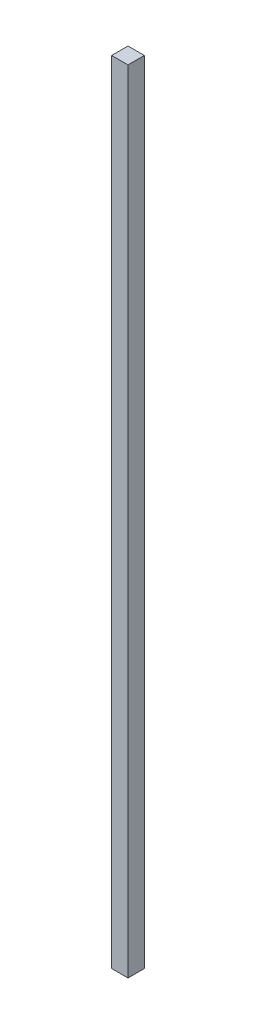
from build123d import *

# Parameters (mm, degrees)
SKETCH21_W           = 207
SKETCH21_H           = 207
BUILDING_3IN_1_DEPTH = 10000


with BuildPart() as part:
    # Sketch21 → Building 3IN(1) (new body)
    with BuildSketch(Plane.ZX):
        with Locations((103.5, 103.5)):
            Rectangle(SKETCH21_W, SKETCH21_H)
    extrude(amount=BUILDING_3IN_1_DEPTH)


solid = part.part
